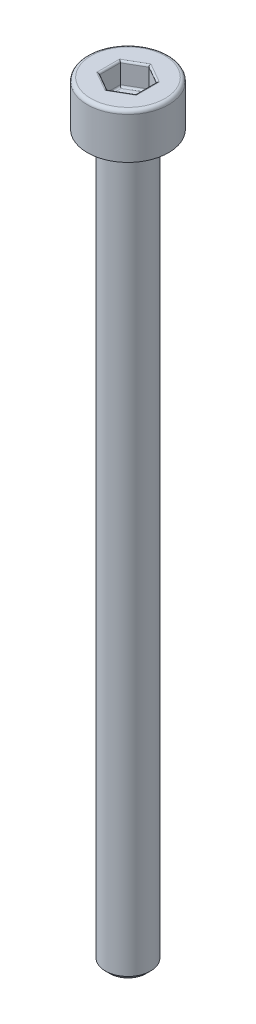
from build123d import *

# Parameters (mm, degrees)
CHAMFER1_SIZE      = 0.25
FILLET1_R          = 0.2
CUT_EXTRUDE1_DEPTH = 1.25
FILLET2_R          = 0.1


with BuildPart() as part:
    # Sketch1 → Revolve1 (revolve)
    with BuildSketch(Plane.XY, mode=Mode.PRIVATE) as revolve1_sk:
        Polygon((0, -42.5), (-1.25, -42.5), (-1.25, -2.5), (-2.25, -2.5), (-2.25, 0), (0, 0), align=None)
    revolve(revolve1_sk.sketch.rotate(Axis((0, 0, 0), (0, -1, 0)), 270), axis=Axis((0, 0, 0), (0, -1, 0)))

    # Chamfer1
    chamfer1_edges = [part.edges().sort_by_distance(p)[0] for p in [
        (0, -2.5, -1.25),
        (0, -42.5, -1.25),
    ]]
    chamfer(chamfer1_edges, length=CHAMFER1_SIZE)

    # Fillet1
    fillet1_edges = [part.edges().sort_by_distance(p)[0] for p in [
        (0, 0, -2.25),
    ]]
    fillet(fillet1_edges, radius=FILLET1_R)

    # Sketch2 → Cut-Extrude1 (cut)
    with BuildSketch(Plane(origin=(0, 0, 0), x_dir=(1, 0, 0), z_dir=(0, 1, 0))):
        Polygon((0, 1.154700538), (-1, 0.577350269), (-1, -0.577350269), (0, -1.154700538), (1, -0.577350269), (1, 0.577350269), align=None)
    extrude(amount=-CUT_EXTRUDE1_DEPTH, mode=Mode.SUBTRACT)

    # Fillet2
    fillet2_edges = [part.edges().sort_by_distance(p)[0] for p in [
        (0.5, -1.25, -0.866025404),
        (1, -1.25, 0),
        (0.5, -1.25, 0.866025404),
        (-0.5, -1.25, 0.866025404),
        (-1, -1.25, 0),
        (-0.5, -1.25, -0.866025404),
        (0.4999999999999987, 0, -0.8660254037844397),
        (-0.5000000000000006, 0, -0.8660254037844395),
        (-1, 0, 0),
        (-0.5000000000000007, 0, 0.8660254037844379),
        (0.4999999999999988, 0, 0.8660254037844382),
        (1, 0, 0),
    ]]
    fillet(fillet2_edges, radius=FILLET2_R)


solid = part.part
